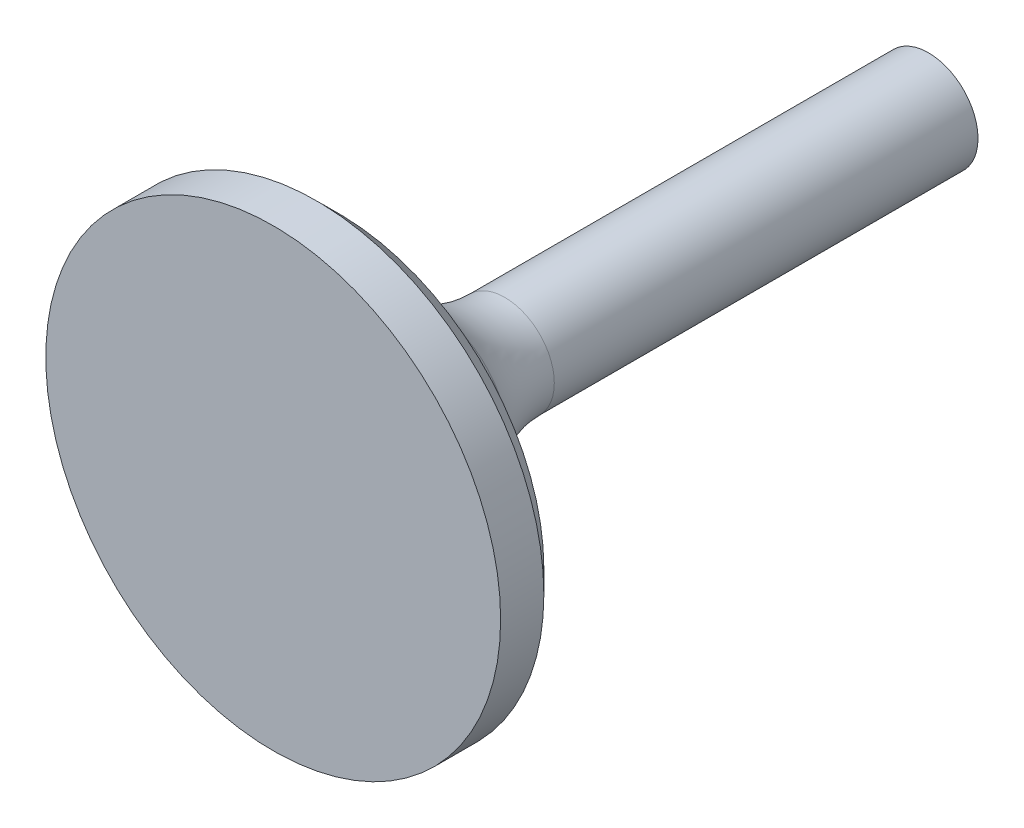
from build123d import *


with BuildPart() as part:
    # Sketch1 → Revolve1 (revolve)
    with BuildSketch(Plane(origin=(0, 0, 0), x_dir=(1, 0, 0), z_dir=(0, 1, 0))):
        with BuildLine():
            Line((0, -23.776136544), (15.478125, -23.776136544))
            Line((15.478125, -23.776136544), (15.478125, -20.835299144))
            Line((15.478125, -20.835299144), (13.9303125, -19.287486644))
            add(Edge.make_bspline(
                [(13.9303125, -19.287486644), (10.319637256, -18.151345226), (7.554662311, -15.828411363), (5.16538433, -12.97064331)],
                knots=[0, 0, 0, 0, 0.797340133, 0.797340133, 0.797340133, 0.797340133], degree=3))
            ThreePointArc((5.16538433, -12.97064331), (3.829388359, -10.649464181), (3.3655, -8.011744452))
            Line((3.3655, -8.011744452), (3.3655, 20.823171826))
            Line((3.3655, 20.823171826), (0, 20.823171826))
            Line((0, 20.823171826), (0, -23.776136544))
        make_face()
    revolve(axis=Axis((0, 0, 23.776136544), (0, 0, -1)))


solid = part.part
